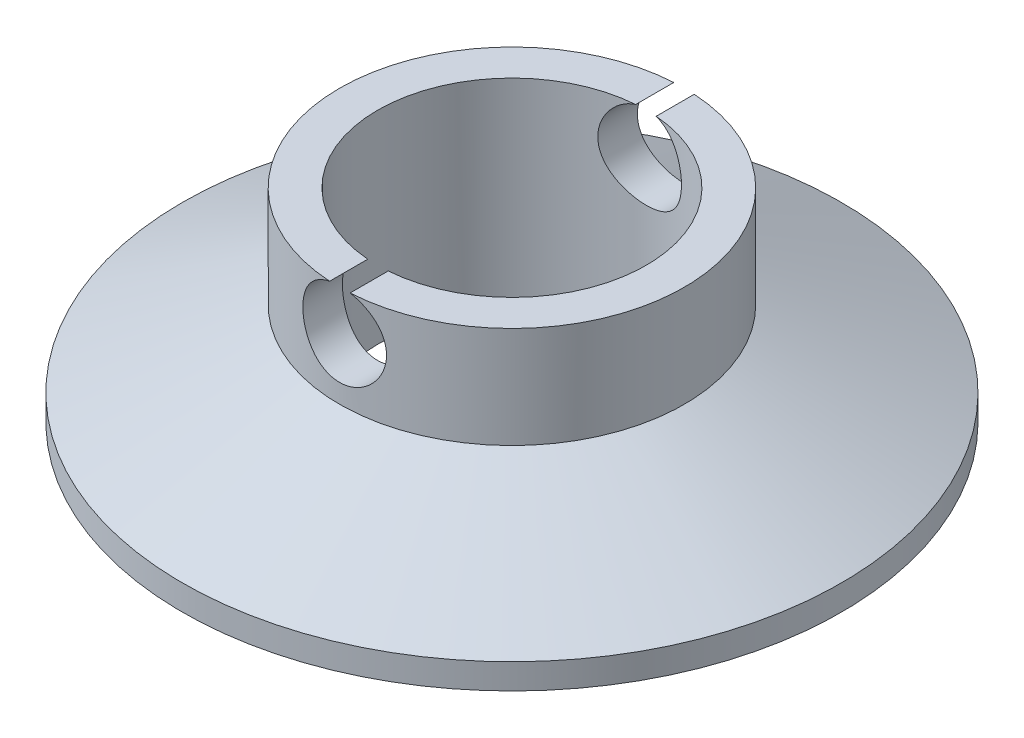
from build123d import *

# Parameters (mm, degrees)
CUT_EXTRUDE_3_DEPTH      = 10
CUT_EXTRUDE_3_DEPTH_BACK = 10
SKETCH_2_R               = 1.65


with BuildPart() as part:
    # 草图1 → 旋转1 (revolve)
    with BuildSketch(Plane.XY):
        Polygon((0, 0), (-7.7, 0), (-7.7, 1), (-1.5, 4), (-1.5, 8), (0, 8), align=None)
    revolve(axis=Axis((5.3, 12.989187483, 0), (0, -1, 0)))

    # 草图2 → 切除-拉伸3 (cut, two sides: drawn at the far end of the back side and taken through both)
    with BuildSketch(Plane.XY.offset(-CUT_EXTRUDE_3_DEPTH_BACK)):
        with Locations((5.3, 6.4)):
            Circle(SKETCH_2_R)
    extrude(amount=CUT_EXTRUDE_3_DEPTH + CUT_EXTRUDE_3_DEPTH_BACK, mode=Mode.SUBTRACT)


solid = part.part
